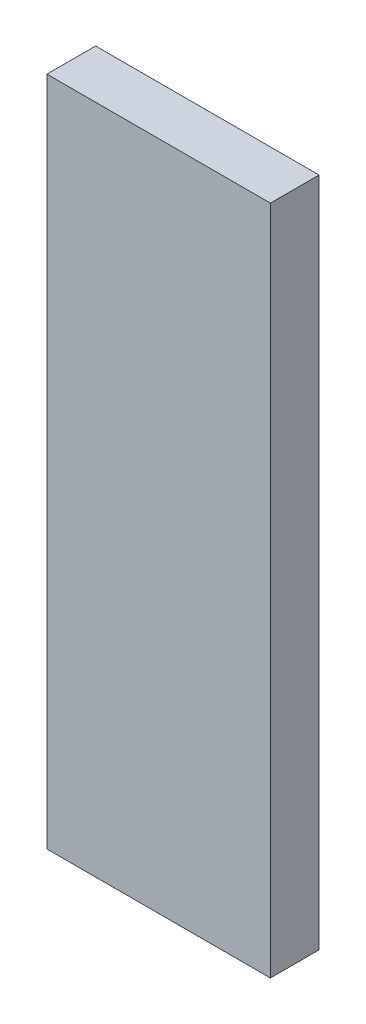
from build123d import *

# Parameters (mm, degrees)
SKETCH1_W           = 32.12
SKETCH1_H           = 96.46
BOSS_EXTRUDE1_DEPTH = 7


with BuildPart() as part:
    # Sketch1 → Boss-Extrude1 (new body)
    with BuildSketch(Plane.XY):
        with Locations((-5.658230088, -17.140265487)):
            Rectangle(SKETCH1_W, SKETCH1_H)
    extrude(amount=BOSS_EXTRUDE1_DEPTH)


solid = part.part
